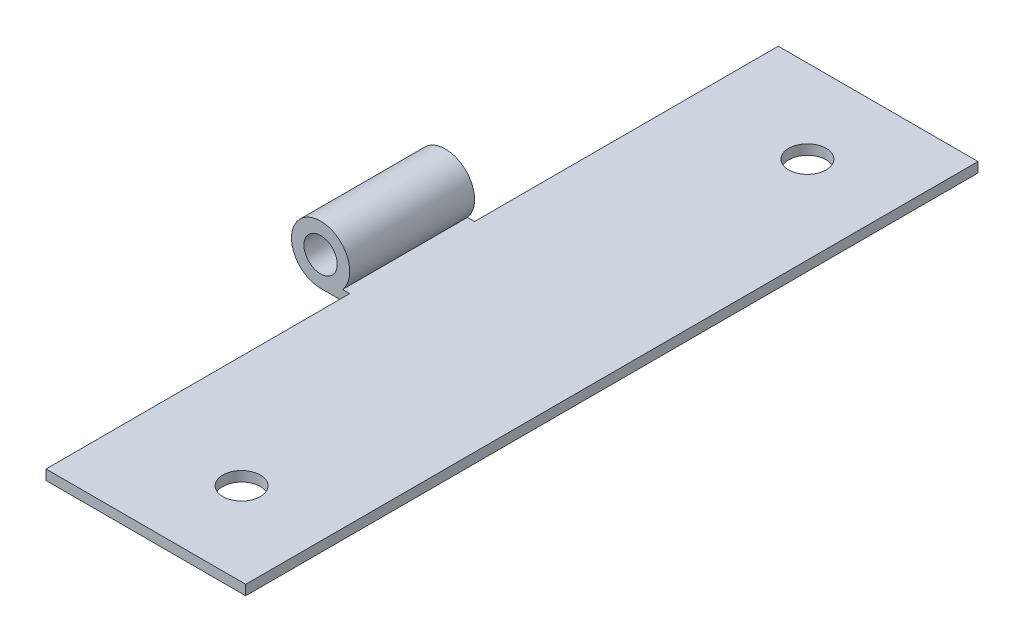
from build123d import *

# Parameters (mm, degrees)
SKETCH1_W           = 24
SKETCH1_H           = 88
BOSS_EXTRUDE1_DEPTH = 1.2
SKETCH2_R           = 2
BOSS_EXTRUDE2_DEPTH = 7.5
SKETCH4_R           = 2.25
CUT_EXTRUDE2_DEPTH  = 49.276702456


with BuildPart() as part:
    # Sketch1 → Boss-Extrude1 (new body)
    with BuildSketch(Plane(origin=(0, 0, 0), x_dir=(1, 0, 0), z_dir=(0, 1, 0))):
        Rectangle(SKETCH1_W, SKETCH1_H)
    extrude(amount=BOSS_EXTRUDE1_DEPTH)

    # Sketch2 → Boss-Extrude2 (add, symmetric)
    with BuildSketch(Plane.XY):
        with BuildLine():
            Line((-12, 0), (-15.5, 0))
            ThreePointArc((-15.5, 0), (-16.949137675, 6.685906464), (-12.861818808, 1.2))
            Line((-12.861818808, 1.2), (-12, 1.2))
            Line((-12, 1.2), (-12, 0))
        make_face()
        with Locations((-15.5, 3.5)):
            Circle(SKETCH2_R, mode=Mode.SUBTRACT)
    extrude(amount=BOSS_EXTRUDE2_DEPTH, both=True)

    # Sketch4 → Cut-Extrude2 (cut, through all)
    with BuildSketch(Plane(origin=(0, 1.2, 0), x_dir=(1, 0, 0), z_dir=(0, 1, 0))):
        with Locations(Location((1.5, 34, 0), (0, 0, 270))):
            Circle(SKETCH4_R)
        with Locations(Location((1.5, -34, 0), (0, 0, 90))):
            Circle(SKETCH4_R)
    extrude(amount=-CUT_EXTRUDE2_DEPTH, mode=Mode.SUBTRACT)


solid = part.part
